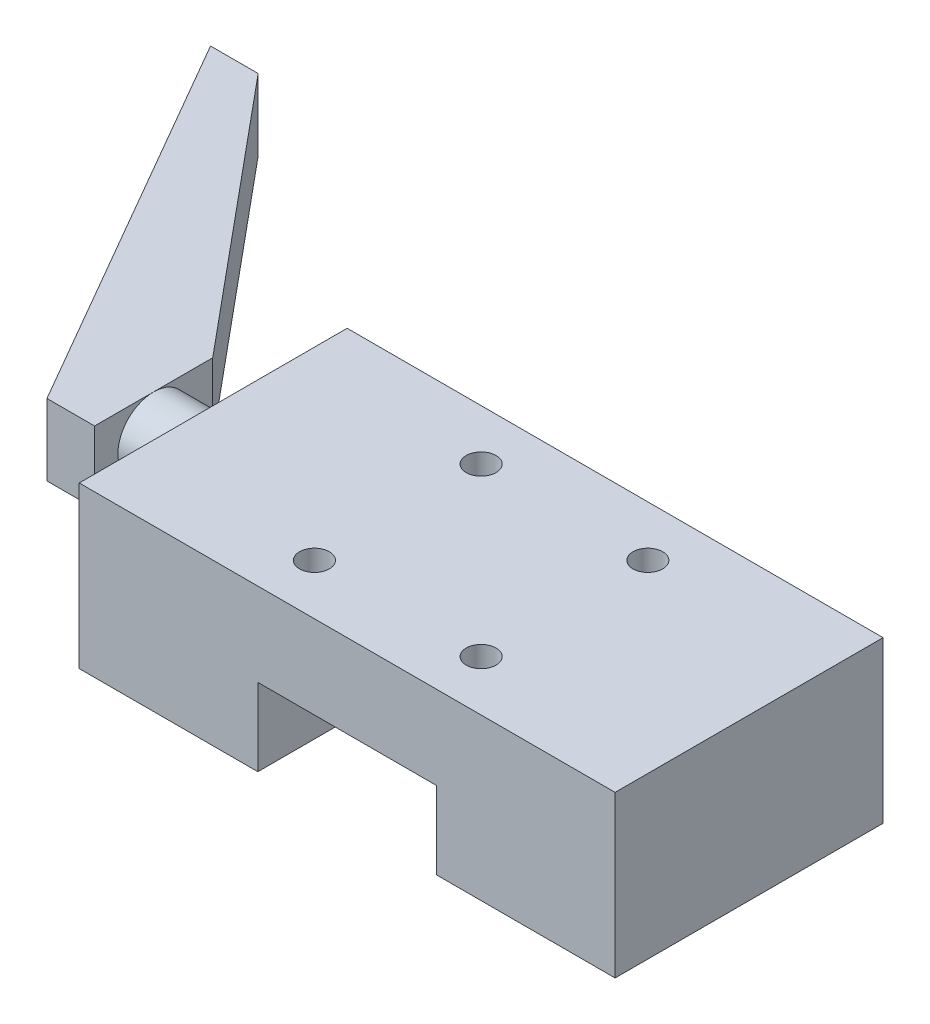
from build123d import *

# Parameters (mm, degrees)
SKETCH_1_W             = 90
SKETCH_1_H             = 27
EXTRUDE_1_DEPTH        = 45
SKETCH_2_W             = 30
SKETCH_2_H             = 26
CUT_EXTRUDE_1_DEPTH    = 66.055745327
HOLE_WIZARD_M6_1_D     = 5
HOLE_WIZARD_M6_1_DEPTH = 11
HOLE_WIZARD_M6_1_TIP   = 1.502151548
SKETCH_6_R             = 6
EXTRUDE_2_DEPTH        = 10
EXTRUDE_3_DEPTH        = 6


with BuildPart() as part:
    # 草图1 → 凸台-拉伸1 (new body)
    with BuildSketch(Plane.XY):
        Rectangle(SKETCH_1_W, SKETCH_1_H)
    extrude(amount=EXTRUDE_1_DEPTH)

    # 草图2 → 切除-拉伸1 (cut, through all)
    with BuildSketch(Plane.XY.offset(45)):
        with Locations((0, -13.5)):
            Rectangle(SKETCH_2_W, SKETCH_2_H)
    extrude(amount=-CUT_EXTRUDE_1_DEPTH, mode=Mode.SUBTRACT)

    # M6 螺纹孔1
    with Locations(Plane(origin=(0, 13.5, 0), x_dir=(1, 0, 0), z_dir=(0, 1, 0))):
        with Locations((-14, -8.5), (14, -8.5), (14, -36.5), (-14, -36.5)):
            Hole(HOLE_WIZARD_M6_1_D / 2, depth=HOLE_WIZARD_M6_1_DEPTH)
            with Locations((0, 0, -(HOLE_WIZARD_M6_1_DEPTH + HOLE_WIZARD_M6_1_TIP / 2))):  # 118° drill point
                Cone(0, HOLE_WIZARD_M6_1_D / 2, HOLE_WIZARD_M6_1_TIP, mode=Mode.SUBTRACT)

    # 草图6 → 凸台-拉伸2 (add)
    with BuildSketch(Plane.ZY.offset(45)):
        with Locations((22.5, 4.5)):
            Circle(SKETCH_6_R)
    extrude(amount=EXTRUDE_2_DEPTH)

    # 草图8 → 凸台-拉伸3 (add, symmetric)
    with BuildSketch(Plane(origin=(0, 4.5, 0), x_dir=(1, 0, 0), z_dir=(0, 1, 0))):
        Polygon((-55, -32.420186034), (-55, -12.579813966), (-92.527767497, 32.579813966), (-100.527767497, 32.579813966), (-63, -32.420186034), align=None)
    extrude(amount=EXTRUDE_3_DEPTH, both=True)


solid = part.part
